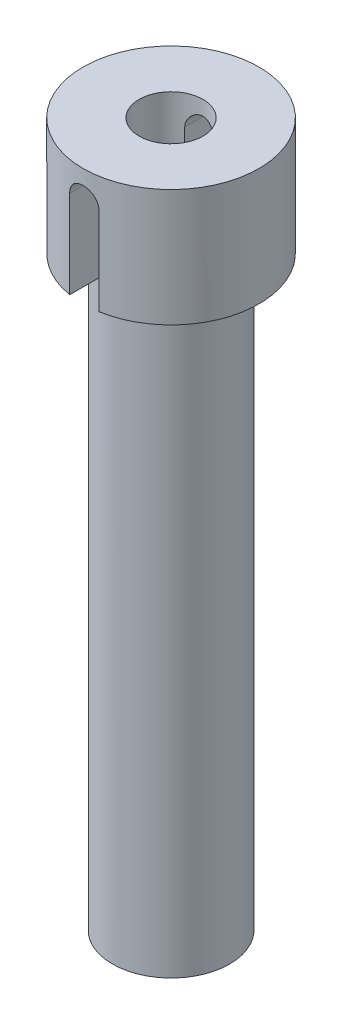
from build123d import *

# Parameters (mm, degrees)
SKETCH1_R                 = 3.175
BOSS_EXTRUDE1_DEPTH       = 31.75
SKETCH4_R                 = 4.7625
BOSS_EXTRUDE2_DEPTH       = 6.35
TAP_DRILL_FOR_8_32_TAP2_D = 3.4544
CUT_EXTRUDE2_DEPTH        = 39.690732902
CUT_EXTRUDE2_DEPTH_BACK   = 39.690732902


with BuildPart() as part:
    # Sketch1 → Boss-Extrude1 (new body)
    with BuildSketch(Plane(origin=(0, 0, 0), x_dir=(1, 0, 0), z_dir=(0, 1, 0))):
        with Locations(Location((0, 0, 0), (0, 0, 270))):
            Circle(SKETCH1_R)
    extrude(amount=BOSS_EXTRUDE1_DEPTH)

    # Sketch4 → Boss-Extrude2 (add)
    with BuildSketch(Plane(origin=(0, 31.75, 0), x_dir=(1, 0, 0), z_dir=(0, 1, 0))):
        with Locations(Location((0, 0, 0), (0, 0, 270))):
            Circle(SKETCH4_R)
    extrude(amount=BOSS_EXTRUDE2_DEPTH)

    # Tap Drill for #8-32 Tap2 (through all)
    with Locations(Plane(origin=(0, 38.1, 0), x_dir=(1, 0, 0), z_dir=(0, 1, 0))):
        with Locations((0, 0)):
            Hole(TAP_DRILL_FOR_8_32_TAP2_D / 2)

    # Sketch8 → Cut-Extrude2 (cut, two sides: drawn at the far end of the back side and taken through both)
    with BuildSketch(Plane.XY.offset(-CUT_EXTRUDE2_DEPTH_BACK)):
        with BuildLine():
            Line((0.79375, 36.5125), (0.79375, 31.75))
            ThreePointArc((0.79375, 31.75), (0, 30.95625), (-0.79375, 31.75))
            Line((-0.79375, 31.75), (-0.79375, 36.5125))
            ThreePointArc((-0.79375, 36.5125), (0, 37.30625), (0.79375, 36.5125))
        make_face()
    extrude(amount=CUT_EXTRUDE2_DEPTH + CUT_EXTRUDE2_DEPTH_BACK, mode=Mode.SUBTRACT)


solid = part.part
